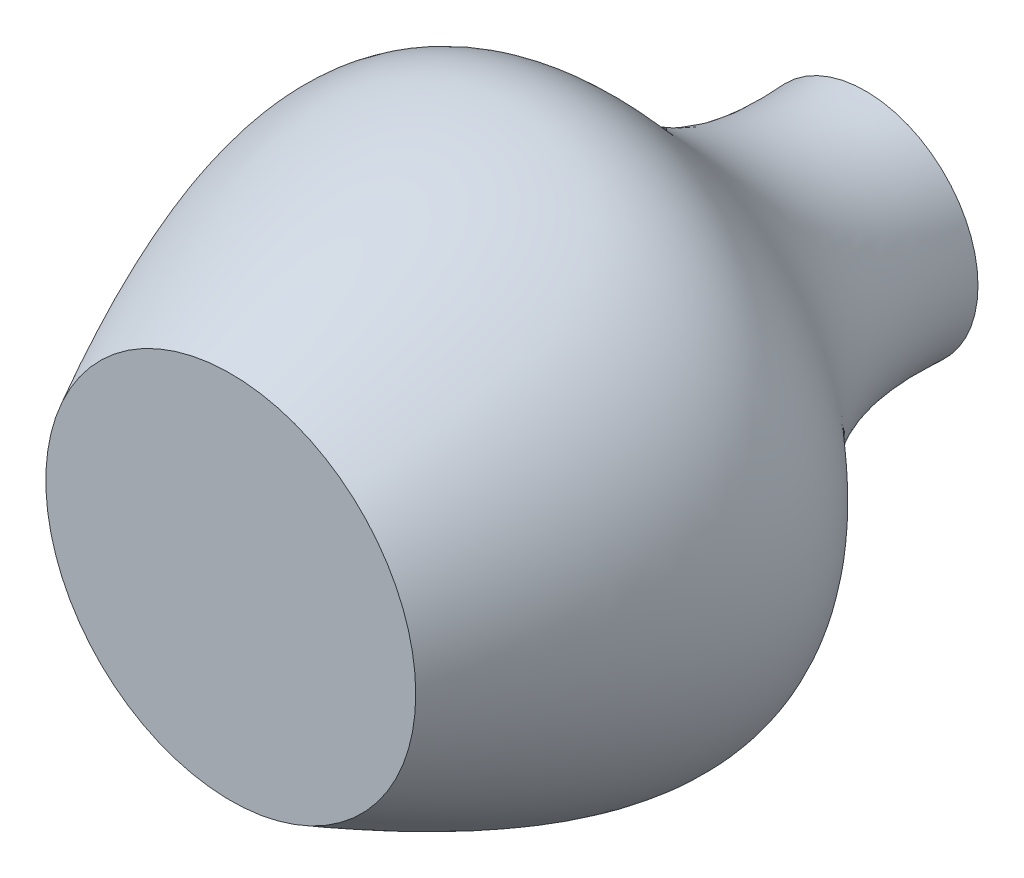
from build123d import *


with BuildPart() as part:
    # Sketch2 → Revolve1 (revolve)
    with BuildSketch(Plane(origin=(0, 0, 0), x_dir=(1, 0, 0), z_dir=(0, 1, 0))):
        with BuildLine():
            Line((0, 0), (0, 68.630174142))
            Line((0, 68.630174142), (-12.160785243, 68.630174142))
            add(Edge.make_bspline(
                [(-20, 0), (-48.281929528, 52.977678285), (-10, 32.990645114), (-12.160785243, 68.630174142)],
                knots=[0, 0, 0, 0, 1, 1, 1, 1], degree=3))
            Line((-20, 0), (0, 0))
        make_face()
    revolve(axis=Axis((0, 0, 0), (0, 0, -1)))


solid = part.part
